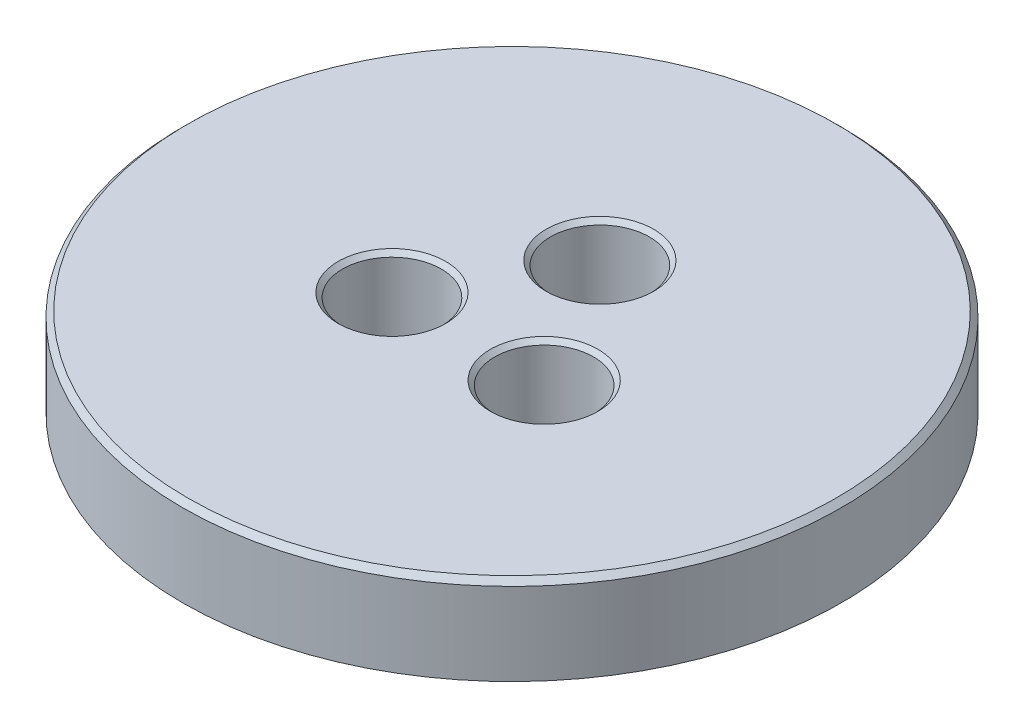
from build123d import *

# Parameters (mm, degrees)
SKETCH1_W          = 7.5
SKETCH1_H          = 2
SKETCH2_R          = 1.125
CUT_EXTRUDE1_DEPTH = 11.793516572
CHAMFER2_SIZE      = 0.1
CHAMFER3_SIZE      = 0.125


with BuildPart() as part:
    # Sketch1 → Revolve1 (revolve)
    with BuildSketch(Plane.XY, mode=Mode.PRIVATE) as revolve1_sk:
        with Locations((3.75, 1)):
            Rectangle(SKETCH1_W, SKETCH1_H)
    revolve(revolve1_sk.sketch.rotate(Axis((0, 0, 0), (0, 1, 0)), 90), axis=Axis((0, 0, 0), (0, 1, 0)))

    # Sketch2 → Cut-Extrude1 (cut, through all)
    with BuildSketch(Plane(origin=(0, 0, 0), x_dir=(1, 0, 0), z_dir=(0, 1, 0))):
        with Locations(Location((-1.732050808, -1, 0), (0, 0, 270))):
            Circle(SKETCH2_R)
        with Locations(Location((1.732050808, -1, 0), (0, 0, 270))):
            Circle(SKETCH2_R)
        with Locations(Location((0, 2, 0), (0, 0, 270))):
            Circle(SKETCH2_R)
    extrude(amount=CUT_EXTRUDE1_DEPTH, mode=Mode.SUBTRACT)

    # Chamfer2
    chamfer2_edges = [part.edges().sort_by_distance(p)[0] for p in [
        (0, 2, -3.125),
        (-1.732050808, 2, -0.125),
        (1.732050808, 2, -0.125),
    ]]
    chamfer(chamfer2_edges, length=CHAMFER2_SIZE)

    # Chamfer3
    chamfer3_edges = [part.edges().sort_by_distance(p)[0] for p in [
        (0, 2, 7.5),
    ]]
    chamfer(chamfer3_edges, length=CHAMFER3_SIZE)


solid = part.part
